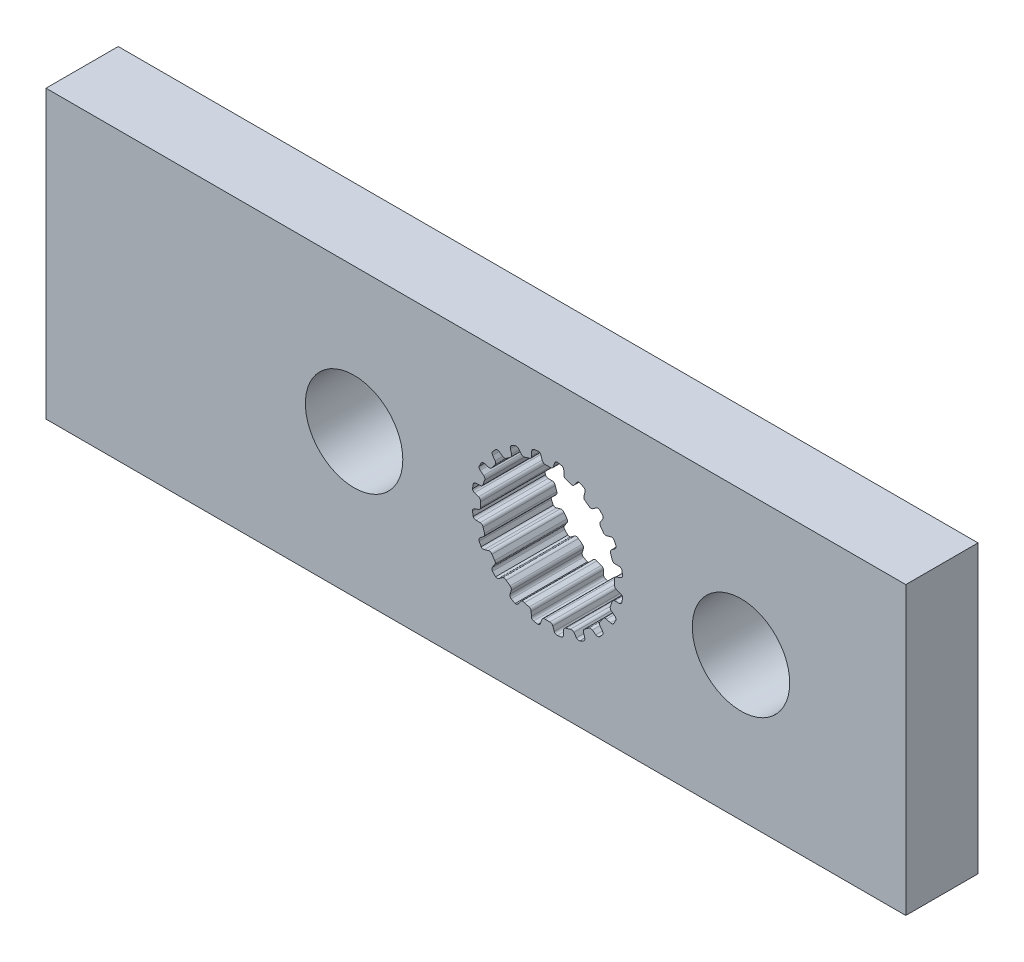
from build123d import *

# Parameters (mm, degrees)
SKETCH1_W           = 38.1
SKETCH1_H           = 12.7
SKETCH1_R           = 2.159
BOSS_EXTRUDE1_DEPTH = 1.6002


with BuildPart() as part:
    # Sketch1 → Boss-Extrude1 (new, symmetric)
    with BuildSketch(Plane.XY):
        with Locations((-3.175, 0)):
            Rectangle(SKETCH1_W, SKETCH1_H)
        with Locations((-8.5725, 0)):
            Circle(SKETCH1_R, mode=Mode.SUBTRACT)
        with Locations((8.5725, 0)):
            Circle(SKETCH1_R, mode=Mode.SUBTRACT)
        with BuildLine():
            Line((-0.106949245, 2.969874934), (0.106949245, 2.969874934))
            ThreePointArc((0.106949245, 2.969874934), (0.196343213, 2.986924176), (0.253739238, 3.057547504))
            Line((0.253739238, 3.057547504), (0.315888147, 3.237526941))
            ThreePointArc((0.315888147, 3.237526941), (0.359032156, 3.298322911), (0.4281449, 3.326269005))
            Line((0.4281449, 3.326269005), (0.620027588, 3.2937547))
            ThreePointArc((0.620027588, 3.2937547), (0.689621142, 3.24802576), (0.718272212, 3.169836791))
            Line((0.718272212, 3.169836791), (0.724389167, 2.979527391))
            ThreePointArc((0.724389167, 2.979527391), (0.750934762, 2.9040661), (0.816027049, 2.857568043))
            Line((0.816027049, 2.857568043), (1.019456602, 2.791469774))
            ThreePointArc((1.019456602, 2.791469774), (1.109743823, 2.780060312), (1.186154496, 2.829490741))
            Line((1.186154496, 2.829490741), (1.300878326, 2.981456288))
            ThreePointArc((1.300878326, 2.981456288), (1.360697704, 3.02594446), (1.435063648, 3.031165762))
            Line((1.435063648, 3.031165762), (1.607507455, 2.940947809))
            ThreePointArc((1.607507455, 2.940947809), (1.659563839, 2.875951412), (1.662650905, 2.792735615))
            Line((1.662650905, 2.792735615), (1.609659636, 2.609850378))
            ThreePointArc((1.609659636, 2.609850378), (1.611587176, 2.529879385), (1.659124931, 2.465542482))
            Line((1.659124931, 2.465542482), (1.832172444, 2.339816104))
            ThreePointArc((1.832172444, 2.339816104), (1.914514976, 2.301064775), (2.002460687, 2.32446371))
            Line((2.002460687, 2.32446371), (2.158529469, 2.433539921))
            ThreePointArc((2.158529469, 2.433539921), (2.229168681, 2.457365482), (2.301508367, 2.439350895))
            Line((2.301508367, 2.439350895), (2.437633293, 2.300260456))
            ThreePointArc((2.437633293, 2.300260456), (2.467056864, 2.222358901), (2.444277744, 2.14226202))
            Line((2.444277744, 2.14226202), (2.337365406, 1.984703026))
            ThreePointArc((2.337365406, 1.984703026), (2.314486209, 1.908050449), (2.339816104, 1.832172444))
            Line((2.339816104, 1.832172444), (2.465542482, 1.659124931))
            ThreePointArc((2.465542482, 1.659124931), (2.531880064, 1.596824985), (2.622752074, 1.591901975))
            Line((2.622752074, 1.591901975), (2.804888709, 1.64741171))
            ThreePointArc((2.804888709, 1.64741171), (2.879433095, 1.648242449), (2.942665411, 1.608755366))
            Line((2.942665411, 1.608755366), (3.0291466, 1.434407582))
            ThreePointArc((3.0291466, 1.434407582), (3.033057175, 1.351226417), (2.986641646, 1.282088892))
            Line((2.986641646, 1.282088892), (2.836273564, 1.165279113))
            ThreePointArc((2.836273564, 1.165279113), (2.790827206, 1.099448241), (2.791469774, 1.019456602))
            Line((2.791469774, 1.019456602), (2.857568043, 0.816027049))
            ThreePointArc((2.857568043, 0.816027049), (2.901407091, 0.736276839), (2.986310214, 0.703513784))
            Line((2.986310214, 0.703513784), (3.1766859, 0.700023363))
            ThreePointArc((3.1766859, 0.700023363), (3.247838536, 0.677777961), (3.295773863, 0.620683653))
            Line((3.295773863, 0.620683653), (3.324145932, 0.4281449))
            ThreePointArc((3.324145932, 0.4281449), (3.302160717, 0.347826477), (3.236652255, 0.29641597))
            Line((3.236652255, 0.29641597), (3.057547504, 0.231789562))
            ThreePointArc((3.057547504, 0.231789562), (2.993982591, 0.183224379), (2.969874934, 0.106949245))
            Line((2.969874934, 0.106949245), (2.969874934, -0.106949245))
            ThreePointArc((2.969874934, -0.106949245), (2.986924176, -0.196343213), (3.057547504, -0.253739238))
            Line((3.057547504, -0.253739238), (3.237526941, -0.315888147))
            ThreePointArc((3.237526941, -0.315888147), (3.298322911, -0.359032156), (3.326269005, -0.4281449))
            Line((3.326269005, -0.4281449), (3.2937547, -0.620027588))
            ThreePointArc((3.2937547, -0.620027588), (3.24802576, -0.689621142), (3.169836791, -0.718272212))
            Line((3.169836791, -0.718272212), (2.979527391, -0.724389167))
            ThreePointArc((2.979527391, -0.724389167), (2.9040661, -0.750934762), (2.857568043, -0.816027049))
            Line((2.857568043, -0.816027049), (2.791469774, -1.019456602))
            ThreePointArc((2.791469774, -1.019456602), (2.780060312, -1.109743823), (2.829490741, -1.186154496))
            Line((2.829490741, -1.186154496), (2.981456288, -1.300878326))
            ThreePointArc((2.981456288, -1.300878326), (3.02594446, -1.360697704), (3.031165762, -1.435063648))
            Line((3.031165762, -1.435063648), (2.940947809, -1.607507455))
            ThreePointArc((2.940947809, -1.607507455), (2.875951412, -1.659563839), (2.792735615, -1.662650905))
            Line((2.792735615, -1.662650905), (2.609850378, -1.609659636))
            ThreePointArc((2.609850378, -1.609659636), (2.529879385, -1.611587176), (2.465542482, -1.659124931))
            Line((2.465542482, -1.659124931), (2.339816104, -1.832172444))
            ThreePointArc((2.339816104, -1.832172444), (2.301064775, -1.914514976), (2.32446371, -2.002460687))
            Line((2.32446371, -2.002460687), (2.433539921, -2.158529469))
            ThreePointArc((2.433539921, -2.158529469), (2.457365482, -2.229168681), (2.439350895, -2.301508367))
            Line((2.439350895, -2.301508367), (2.300260456, -2.437633293))
            ThreePointArc((2.300260456, -2.437633293), (2.222358901, -2.467056864), (2.14226202, -2.444277744))
            Line((2.14226202, -2.444277744), (1.984703026, -2.337365406))
            ThreePointArc((1.984703026, -2.337365406), (1.908050449, -2.314486209), (1.832172444, -2.339816104))
            Line((1.832172444, -2.339816104), (1.659124931, -2.465542482))
            ThreePointArc((1.659124931, -2.465542482), (1.596824985, -2.531880064), (1.591901975, -2.622752074))
            Line((1.591901975, -2.622752074), (1.64741171, -2.804888709))
            ThreePointArc((1.64741171, -2.804888709), (1.648242449, -2.879433095), (1.608755366, -2.942665411))
            Line((1.608755366, -2.942665411), (1.434407582, -3.0291466))
            ThreePointArc((1.434407582, -3.0291466), (1.351226417, -3.033057175), (1.282088892, -2.986641646))
            Line((1.282088892, -2.986641646), (1.165279113, -2.836273564))
            ThreePointArc((1.165279113, -2.836273564), (1.099448241, -2.790827206), (1.019456602, -2.791469774))
            Line((1.019456602, -2.791469774), (0.816027049, -2.857568043))
            ThreePointArc((0.816027049, -2.857568043), (0.736276839, -2.901407091), (0.703513784, -2.986310214))
            Line((0.703513784, -2.986310214), (0.700023363, -3.1766859))
            ThreePointArc((0.700023363, -3.1766859), (0.677777961, -3.247838536), (0.620683653, -3.295773863))
            Line((0.620683653, -3.295773863), (0.4281449, -3.324145932))
            ThreePointArc((0.4281449, -3.324145932), (0.347826477, -3.302160717), (0.29641597, -3.236652255))
            Line((0.29641597, -3.236652255), (0.231789562, -3.057547504))
            ThreePointArc((0.231789562, -3.057547504), (0.183224379, -2.993982591), (0.106949245, -2.969874934))
            Line((0.106949245, -2.969874934), (-0.106949245, -2.969874934))
            ThreePointArc((-0.106949245, -2.969874934), (-0.196343213, -2.986924176), (-0.253739238, -3.057547504))
            Line((-0.253739238, -3.057547504), (-0.315888147, -3.237526941))
            ThreePointArc((-0.315888147, -3.237526941), (-0.359032156, -3.298322911), (-0.4281449, -3.326269005))
            Line((-0.4281449, -3.326269005), (-0.620027588, -3.2937547))
            ThreePointArc((-0.620027588, -3.2937547), (-0.689621142, -3.24802576), (-0.718272212, -3.169836791))
            Line((-0.718272212, -3.169836791), (-0.724389167, -2.979527391))
            ThreePointArc((-0.724389167, -2.979527391), (-0.750934762, -2.9040661), (-0.816027049, -2.857568043))
            Line((-0.816027049, -2.857568043), (-1.019456602, -2.791469774))
            ThreePointArc((-1.019456602, -2.791469774), (-1.109743823, -2.780060312), (-1.186154496, -2.829490741))
            Line((-1.186154496, -2.829490741), (-1.300878326, -2.981456288))
            ThreePointArc((-1.300878326, -2.981456288), (-1.360697704, -3.02594446), (-1.435063648, -3.031165762))
            Line((-1.435063648, -3.031165762), (-1.607507455, -2.940947809))
            ThreePointArc((-1.607507455, -2.940947809), (-1.659563839, -2.875951412), (-1.662650905, -2.792735615))
            Line((-1.662650905, -2.792735615), (-1.609659636, -2.609850378))
            ThreePointArc((-1.609659636, -2.609850378), (-1.611587176, -2.529879385), (-1.659124931, -2.465542482))
            Line((-1.659124931, -2.465542482), (-1.832172444, -2.339816104))
            ThreePointArc((-1.832172444, -2.339816104), (-1.914514976, -2.301064775), (-2.002460687, -2.32446371))
            Line((-2.002460687, -2.32446371), (-2.158529469, -2.433539921))
            ThreePointArc((-2.158529469, -2.433539921), (-2.229168681, -2.457365482), (-2.301508367, -2.439350895))
            Line((-2.301508367, -2.439350895), (-2.437633293, -2.300260456))
            ThreePointArc((-2.437633293, -2.300260456), (-2.467056864, -2.222358901), (-2.444277744, -2.14226202))
            Line((-2.444277744, -2.14226202), (-2.337365406, -1.984703026))
            ThreePointArc((-2.337365406, -1.984703026), (-2.314486209, -1.908050449), (-2.339816104, -1.832172444))
            Line((-2.339816104, -1.832172444), (-2.465542482, -1.659124931))
            ThreePointArc((-2.465542482, -1.659124931), (-2.531880064, -1.596824985), (-2.622752074, -1.591901975))
            Line((-2.622752074, -1.591901975), (-2.804888709, -1.64741171))
            ThreePointArc((-2.804888709, -1.64741171), (-2.879433095, -1.648242449), (-2.942665411, -1.608755366))
            Line((-2.942665411, -1.608755366), (-3.0291466, -1.434407582))
            ThreePointArc((-3.0291466, -1.434407582), (-3.033057175, -1.351226417), (-2.986641646, -1.282088892))
            Line((-2.986641646, -1.282088892), (-2.836273564, -1.165279113))
            ThreePointArc((-2.836273564, -1.165279113), (-2.790827206, -1.099448241), (-2.791469774, -1.019456602))
            Line((-2.791469774, -1.019456602), (-2.857568043, -0.816027049))
            ThreePointArc((-2.857568043, -0.816027049), (-2.901407091, -0.736276839), (-2.986310214, -0.703513784))
            Line((-2.986310214, -0.703513784), (-3.1766859, -0.700023363))
            ThreePointArc((-3.1766859, -0.700023363), (-3.247838536, -0.677777961), (-3.295773863, -0.620683653))
            Line((-3.295773863, -0.620683653), (-3.324145932, -0.4281449))
            ThreePointArc((-3.324145932, -0.4281449), (-3.302160717, -0.347826477), (-3.236652255, -0.29641597))
            Line((-3.236652255, -0.29641597), (-3.057547504, -0.231789562))
            ThreePointArc((-3.057547504, -0.231789562), (-2.993982591, -0.183224379), (-2.969874934, -0.106949245))
            Line((-2.969874934, -0.106949245), (-2.969874934, 0.106949245))
            ThreePointArc((-2.969874934, 0.106949245), (-2.986924176, 0.196343213), (-3.057547504, 0.253739238))
            Line((-3.057547504, 0.253739238), (-3.237526941, 0.315888147))
            ThreePointArc((-3.237526941, 0.315888147), (-3.298322911, 0.359032156), (-3.326269005, 0.4281449))
            Line((-3.326269005, 0.4281449), (-3.2937547, 0.620027588))
            ThreePointArc((-3.2937547, 0.620027588), (-3.24802576, 0.689621142), (-3.169836791, 0.718272212))
            Line((-3.169836791, 0.718272212), (-2.979527391, 0.724389167))
            ThreePointArc((-2.979527391, 0.724389167), (-2.9040661, 0.750934762), (-2.857568043, 0.816027049))
            Line((-2.857568043, 0.816027049), (-2.791469774, 1.019456602))
            ThreePointArc((-2.791469774, 1.019456602), (-2.780060312, 1.109743823), (-2.829490741, 1.186154496))
            Line((-2.829490741, 1.186154496), (-2.981456288, 1.300878326))
            ThreePointArc((-2.981456288, 1.300878326), (-3.02594446, 1.360697704), (-3.031165762, 1.435063648))
            Line((-3.031165762, 1.435063648), (-2.940947809, 1.607507455))
            ThreePointArc((-2.940947809, 1.607507455), (-2.875951412, 1.659563839), (-2.792735615, 1.662650905))
            Line((-2.792735615, 1.662650905), (-2.609850378, 1.609659636))
            ThreePointArc((-2.609850378, 1.609659636), (-2.529879385, 1.611587176), (-2.465542482, 1.659124931))
            Line((-2.465542482, 1.659124931), (-2.339816104, 1.832172444))
            ThreePointArc((-2.339816104, 1.832172444), (-2.301064775, 1.914514976), (-2.32446371, 2.002460687))
            Line((-2.32446371, 2.002460687), (-2.433539921, 2.158529469))
            ThreePointArc((-2.433539921, 2.158529469), (-2.457365482, 2.229168681), (-2.439350895, 2.301508367))
            Line((-2.439350895, 2.301508367), (-2.300260456, 2.437633293))
            ThreePointArc((-2.300260456, 2.437633293), (-2.222358901, 2.467056864), (-2.14226202, 2.444277744))
            Line((-2.14226202, 2.444277744), (-1.984703026, 2.337365406))
            ThreePointArc((-1.984703026, 2.337365406), (-1.908050449, 2.314486209), (-1.832172444, 2.339816104))
            Line((-1.832172444, 2.339816104), (-1.659124931, 2.465542482))
            ThreePointArc((-1.659124931, 2.465542482), (-1.596824985, 2.531880064), (-1.591901975, 2.622752074))
            Line((-1.591901975, 2.622752074), (-1.64741171, 2.804888709))
            ThreePointArc((-1.64741171, 2.804888709), (-1.648242449, 2.879433095), (-1.608755366, 2.942665411))
            Line((-1.608755366, 2.942665411), (-1.434407582, 3.0291466))
            ThreePointArc((-1.434407582, 3.0291466), (-1.351226417, 3.033057175), (-1.282088892, 2.986641646))
            Line((-1.282088892, 2.986641646), (-1.165279113, 2.836273564))
            ThreePointArc((-1.165279113, 2.836273564), (-1.099448241, 2.790827206), (-1.019456602, 2.791469774))
            Line((-1.019456602, 2.791469774), (-0.816027049, 2.857568043))
            ThreePointArc((-0.816027049, 2.857568043), (-0.736276839, 2.901407091), (-0.703513784, 2.986310214))
            Line((-0.703513784, 2.986310214), (-0.700023363, 3.1766859))
            ThreePointArc((-0.700023363, 3.1766859), (-0.677777961, 3.247838536), (-0.620683653, 3.295773863))
            Line((-0.620683653, 3.295773863), (-0.4281449, 3.324145932))
            ThreePointArc((-0.4281449, 3.324145932), (-0.347826477, 3.302160717), (-0.29641597, 3.236652255))
            Line((-0.29641597, 3.236652255), (-0.231789562, 3.057547504))
            ThreePointArc((-0.231789562, 3.057547504), (-0.183224379, 2.993982591), (-0.106949245, 2.969874934))
        make_face(mode=Mode.SUBTRACT)
    extrude(amount=BOSS_EXTRUDE1_DEPTH, both=True)


solid = part.part
